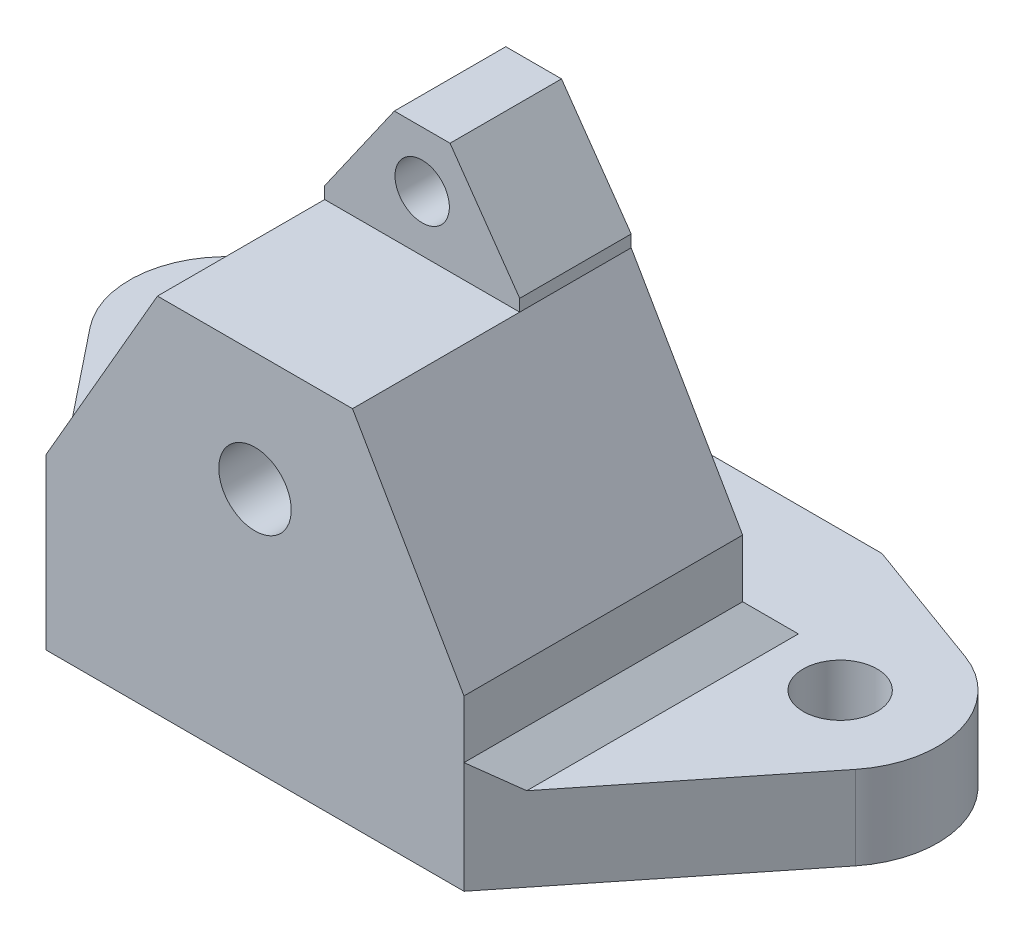
from build123d import *

# Parameters (mm, degrees)
SKETCH1_W           = 30
SKETCH1_H           = 26
BOSS_EXTRUDE1_DEPTH = 30
SKETCH2_R           = 5.25
CUT_EXTRUDE1_DEPTH  = 15
CUT_EXTRUDE2_REACH  = 37.972
SKETCH3_R           = 2.6
SKETCH4_R           = 2.65
BOSS_EXTRUDE2_DEPTH = 6
CHAMFER1_SIZE       = 8
CHAMFER1_SIZE2      = 13.856406461
SKETCH5_W           = 10
SKETCH5_H           = 20
CUT_EXTRUDE3_DEPTH  = 20
CHAMFER2_SIZE       = 2
SKETCH6_W           = 14
SKETCH6_H           = 8
SKETCH6_R           = 1.95
BOSS_EXTRUDE3_DEPTH = 8
CHAMFER3_SIZE       = 5
CHAMFER3_SIZE2      = 7.140740034


with BuildPart() as part:
    # Sketch1 → Boss-Extrude1 (new body)
    with BuildSketch(Plane.XY):
        Rectangle(SKETCH1_W, SKETCH1_H)
    extrude(amount=BOSS_EXTRUDE1_DEPTH)

    # Sketch2 → Cut-Extrude1 (cut)
    with BuildSketch(Plane.XY):
        with Locations((0, 5)):
            Circle(SKETCH2_R)
    extrude(amount=CUT_EXTRUDE1_DEPTH, mode=Mode.SUBTRACT)

    # Sketch3 → Cut-Extrude2 (cut, up to next)
    with BuildSketch(Plane.XY, mode=Mode.PRIVATE) as cut_extrude2_sk1:
        with Locations((0, 4.5)):
            Circle(SKETCH3_R)
    cut_extrude2_tool1 = extrude(cut_extrude2_sk1.sketch, amount=CUT_EXTRUDE2_REACH, mode=Mode.PRIVATE) & part.part
    add(cut_extrude2_tool1.solids().sort_by_distance((0, 4.5, 0))[0], mode=Mode.SUBTRACT)

    # Sketch4 → Boss-Extrude2 (add)
    # profile 1 of 2: a face of its own
    with BuildSketch(Plane.XZ.offset(13)):
        with BuildLine():
            Line((-15, 30), (-27.472160356, 14.365256125))
            ThreePointArc((-27.472160356, 14.365256125), (-28.738776961, 8.10556471), (-24.395973154, 3.422818792))
            Line((-24.395973154, 3.422818792), (-15, 0))
            Line((-15, 0), (-15, 30))
        make_face()
        with Locations(Location((-22, 10, 0), (0, 0, 270))):
            Circle(SKETCH4_R, mode=Mode.SUBTRACT)
    # profile 2 of 2: a face of its own
    with BuildSketch(Plane.XZ.offset(13)):
        with BuildLine():
            Line((15, 0), (24.395973154, 3.422818792))
            ThreePointArc((24.395973154, 3.422818792), (28.738776961, 8.10556471), (27.472160356, 14.365256125))
            Line((27.472160356, 14.365256125), (15, 30))
            Line((15, 30), (15, 0))
        make_face()
        with Locations(Location((22, 10, 0), (0, 0, 90))):
            Circle(SKETCH4_R, mode=Mode.SUBTRACT)
    extrude(amount=-BOSS_EXTRUDE2_DEPTH)

    # Chamfer1
    chamfer1_edges = [part.edges().sort_by_distance(p)[0] for p in [
        (-15, 13, 15),
        (15, 13, 15),
    ]]
    chamfer1_side = [part.faces().sort_by_distance(p)[0] for p in [
        (0, 13, 15),
    ]]
    chamfer(chamfer1_edges, length=CHAMFER1_SIZE, length2=CHAMFER1_SIZE2, reference=chamfer1_side[0])

    # Sketch5 → Cut-Extrude3 (cut, symmetric)
    with BuildSketch(Plane(origin=(0, 0, 0), x_dir=(0, 0, -1), z_dir=(1, 0, 0))):
        with Locations((-5, 3)):
            Rectangle(SKETCH5_W, SKETCH5_H)
    extrude(amount=CUT_EXTRUDE3_DEPTH, both=True, mode=Mode.SUBTRACT)

    # Chamfer2
    chamfer2_edges = [part.edges().sort_by_distance(p)[0] for p in [
        (-15, -7, 20),
        (15, -7, 20),
        (0, -7, 10),
    ]]
    chamfer(chamfer2_edges, length=CHAMFER2_SIZE)

    # Sketch6 → Boss-Extrude3 (add)
    with BuildSketch(Plane(origin=(0, 0, 10), x_dir=(-1, 0, 0), z_dir=(0, 0, -1))):
        with Locations((0, 17)):
            Rectangle(SKETCH6_W, SKETCH6_H)
        with Locations((0, 17)):
            Circle(SKETCH6_R, mode=Mode.SUBTRACT)
    extrude(amount=-BOSS_EXTRUDE3_DEPTH)

    # Chamfer3
    chamfer3_edges = [part.edges().sort_by_distance(p)[0] for p in [
        (7, 21, 14),
        (-7, 21, 14),
    ]]
    chamfer3_side = [part.faces().sort_by_distance(p)[0] for p in [
        (0, 21, 14),
    ]]
    chamfer(chamfer3_edges, length=CHAMFER3_SIZE, length2=CHAMFER3_SIZE2, reference=chamfer3_side[0])


solid = part.part
